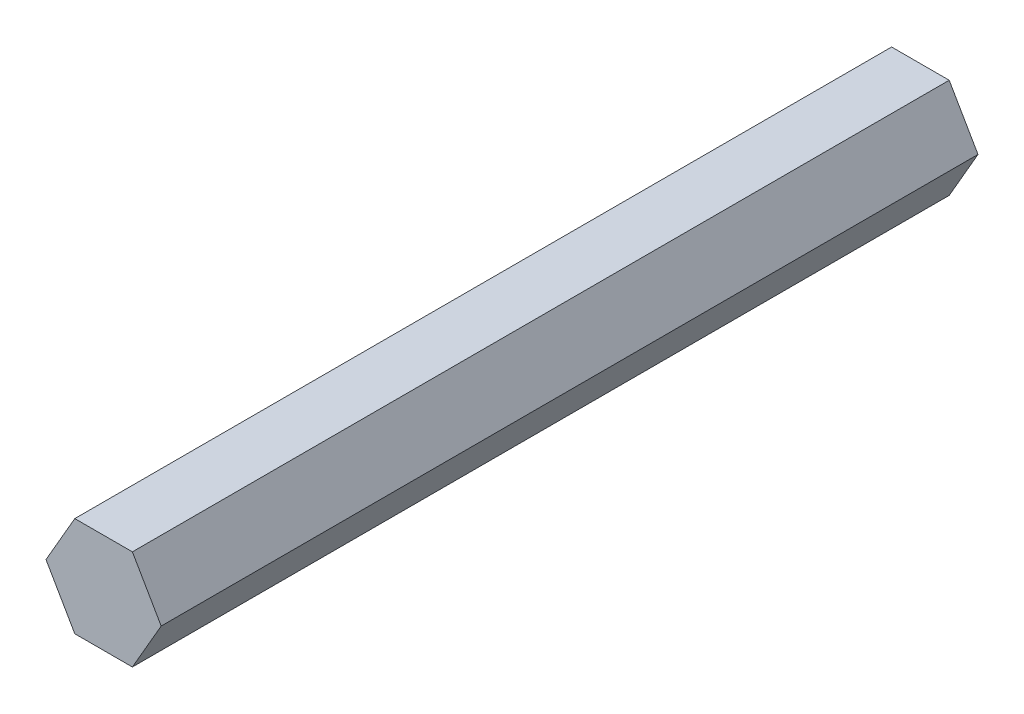
from build123d import *

# Parameters (mm, degrees)
BOSS_EXTRUDE1_DEPTH = 104


with BuildPart() as part:
    # Sketch1 → Boss-Extrude1 (new body)
    with BuildSketch(Plane.XY):
        Polygon((7.332348419, 0), (3.666174209, 6.35), (-3.666174209, 6.35), (-7.332348419, 0), (-3.666174209, -6.35), (3.666174209, -6.35), align=None)
    extrude(amount=BOSS_EXTRUDE1_DEPTH)


solid = part.part
